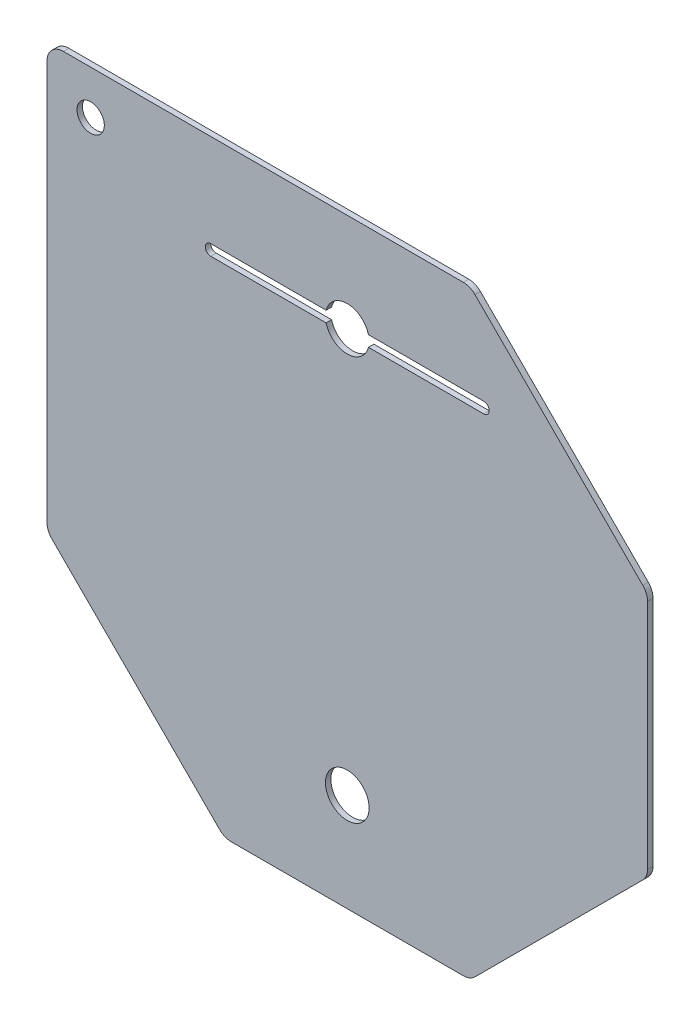
from build123d import *

# Parameters (mm, degrees)
SKETCH1_R           = 2.5
SKETCH1_R_2         = 4
BOSS_EXTRUDE1_DEPTH = 1


with BuildPart() as part:
    # Sketch1 → Boss-Extrude1 (new body)
    with BuildSketch(Plane.XY):
        with BuildLine():
            Line((55, -21.257359313), (55, 21.257359313))
            ThreePointArc((55, 21.257359313), (54.771638598, 22.40540961), (54.121320344, 23.378679656))
            Line((54.121320344, 23.378679656), (23.378679656, 54.121320344))
            ThreePointArc((23.378679656, 54.121320344), (22.40540961, 54.771638598), (21.257359313, 55))
            Line((21.257359313, 55), (-52, 55))
            ThreePointArc((-52, 55), (-54.121320344, 54.121320344), (-55, 52))
            Line((-55, 52), (-55, -21.257359313))
            ThreePointArc((-55, -21.257359313), (-54.771638598, -22.40540961), (-54.121320344, -23.378679656))
            Line((-54.121320344, -23.378679656), (-23.378679656, -54.121320344))
            ThreePointArc((-23.378679656, -54.121320344), (-22.40540961, -54.771638598), (-21.257359313, -55))
            Line((-21.257359313, -55), (21.257359313, -55))
            ThreePointArc((21.257359313, -55), (22.40540961, -54.771638598), (23.378679656, -54.121320344))
            Line((23.378679656, -54.121320344), (54.121320344, -23.378679656))
            ThreePointArc((54.121320344, -23.378679656), (54.771638598, -22.40540961), (55, -21.257359313))
        make_face()
        with Locations((-47, 47)):
            Circle(SKETCH1_R, mode=Mode.SUBTRACT)
        with Locations((0, -37)):
            Circle(SKETCH1_R_2, mode=Mode.SUBTRACT)
        with BuildLine():
            Line((-25, 38), (-3.872983346, 38))
            ThreePointArc((-3.872983346, 38), (0, 41), (3.872983346, 38))
            Line((3.872983346, 38), (25, 38))
            ThreePointArc((25, 38), (26, 37), (25, 36))
            Line((25, 36), (3.872983346, 36))
            ThreePointArc((3.872983346, 36), (0, 33), (-3.872983346, 36))
            Line((-3.872983346, 36), (-25, 36))
            ThreePointArc((-25, 36), (-26, 37), (-25, 38))
        make_face(mode=Mode.SUBTRACT)
    extrude(amount=BOSS_EXTRUDE1_DEPTH)


solid = part.part
